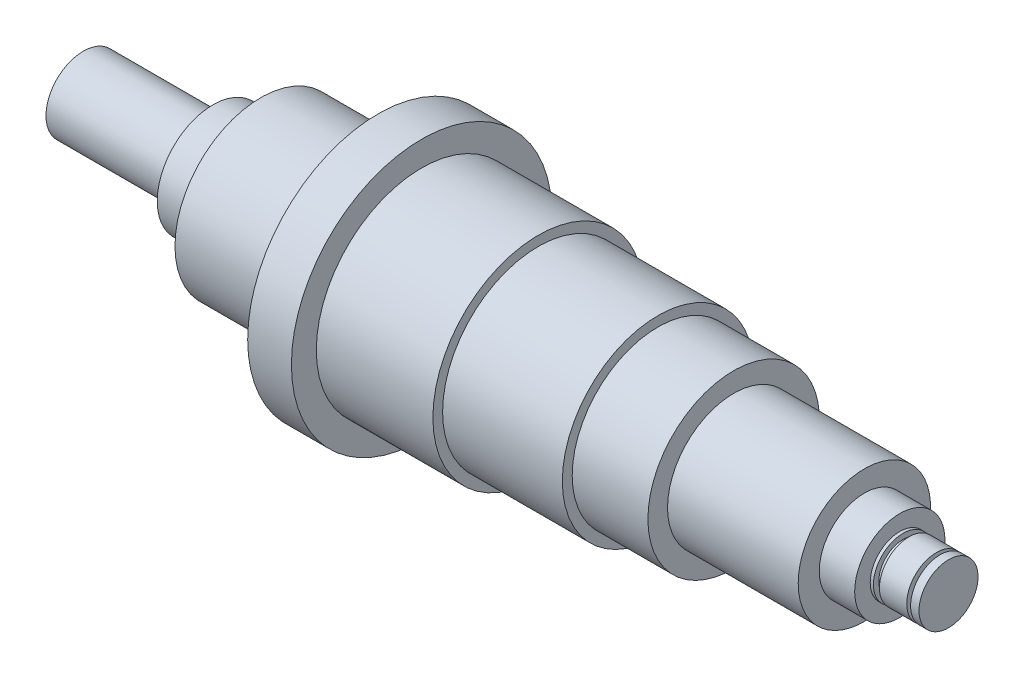
from build123d import *


with BuildPart() as part:
    # Sketch1 → Revolve12 (revolve)
    with BuildSketch(Plane.XY, mode=Mode.PRIVATE) as revolve12_sk:
        Polygon((-622.932317141, 31.592394831), (-732.666569538, 31.592394831), (-732.666569538, 0), (0, 0), (0, 25), (-7.148288714, 25), (-7.148288714, 20.471740038), (-10.38496903, 20.471740038), (-10.38496903, 25), (-33.504114148, 25), (-33.504114148, 20.471740038), (-38.590326073, 20.471740038), (-38.590326073, 25), (-41.31104031, 25), (-41.31104031, 38.184789663), (-71.265035392, 38.184789663), (-71.265035392, 56.024235632), (-181.930073101, 56.024235632), (-181.930073101, 72.654227637), (-246.031133195, 72.654227637), (-246.031133195, 81.010731097), (-347.41741521, 81.010731097), (-347.41741521, 89.237521362), (-446.138898381, 89.237521362), (-446.138898381, 110.318671414), (-483.15945457, 110.318671414), (-483.15945457, 72.654227637), (-582.395112132, 72.654227637), (-582.395112132, 47.104512647), (-622.932317141, 47.104512647), align=None)
    revolve(revolve12_sk.sketch.rotate(Axis((-732.666569538, 0, 0), (1, 0, 0)), 90), axis=Axis((-732.666569538, 0, 0), (1, 0, 0)))


solid = part.part
